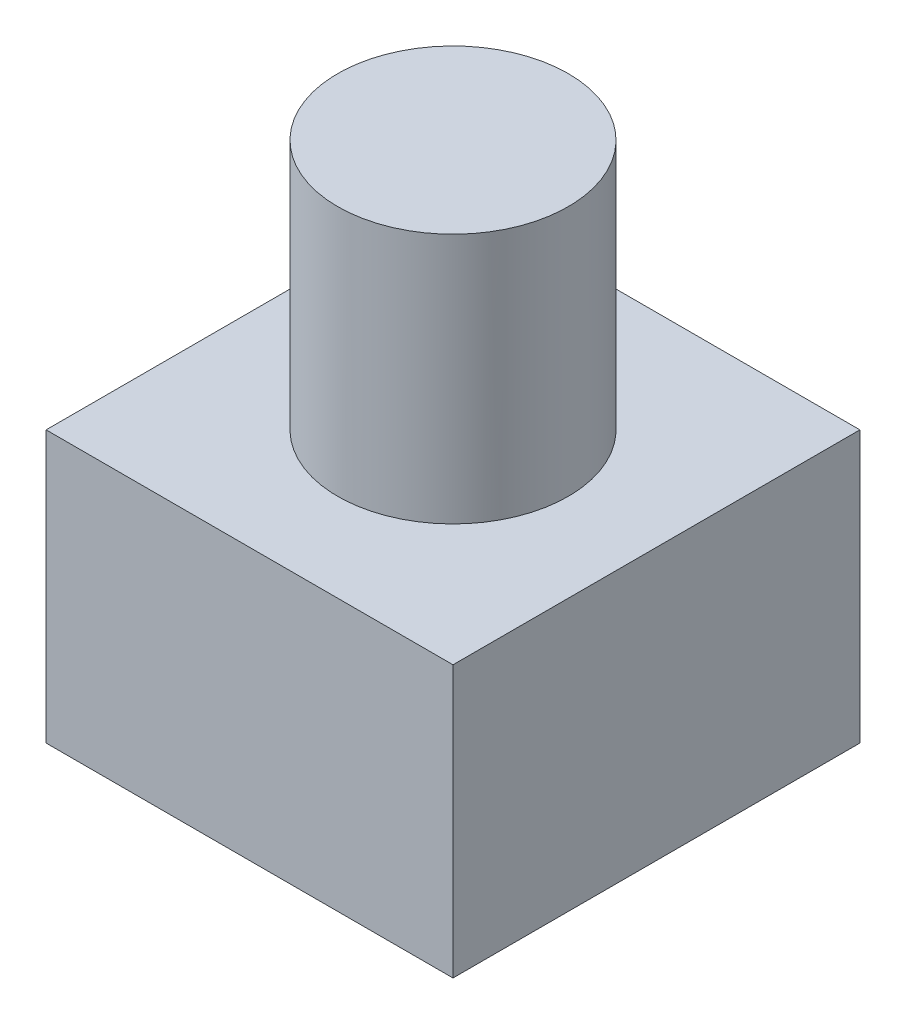
from build123d import *

# Parameters (mm, degrees)
SKETCH1_W           = 6
SKETCH1_H           = 6
BOSS_EXTRUDE1_DEPTH = 4
SKETCH2_R           = 1.7
BOSS_EXTRUDE2_DEPTH = 3.7


with BuildPart() as part:
    # Sketch1 → Boss-Extrude1 (new body)
    with BuildSketch(Plane(origin=(0, 0, 0), x_dir=(1, 0, 0), z_dir=(0, 1, 0))):
        with Locations((3, 3)):
            Rectangle(SKETCH1_W, SKETCH1_H)
    extrude(amount=BOSS_EXTRUDE1_DEPTH)

    # Sketch2 → Boss-Extrude2 (add)
    with BuildSketch(Plane(origin=(0, 4, 0), x_dir=(1, 0, 0), z_dir=(0, 1, 0))):
        with Locations(Location((3, 3, 0), (0, 0, 90))):
            Circle(SKETCH2_R)
    extrude(amount=BOSS_EXTRUDE2_DEPTH)


solid = part.part
